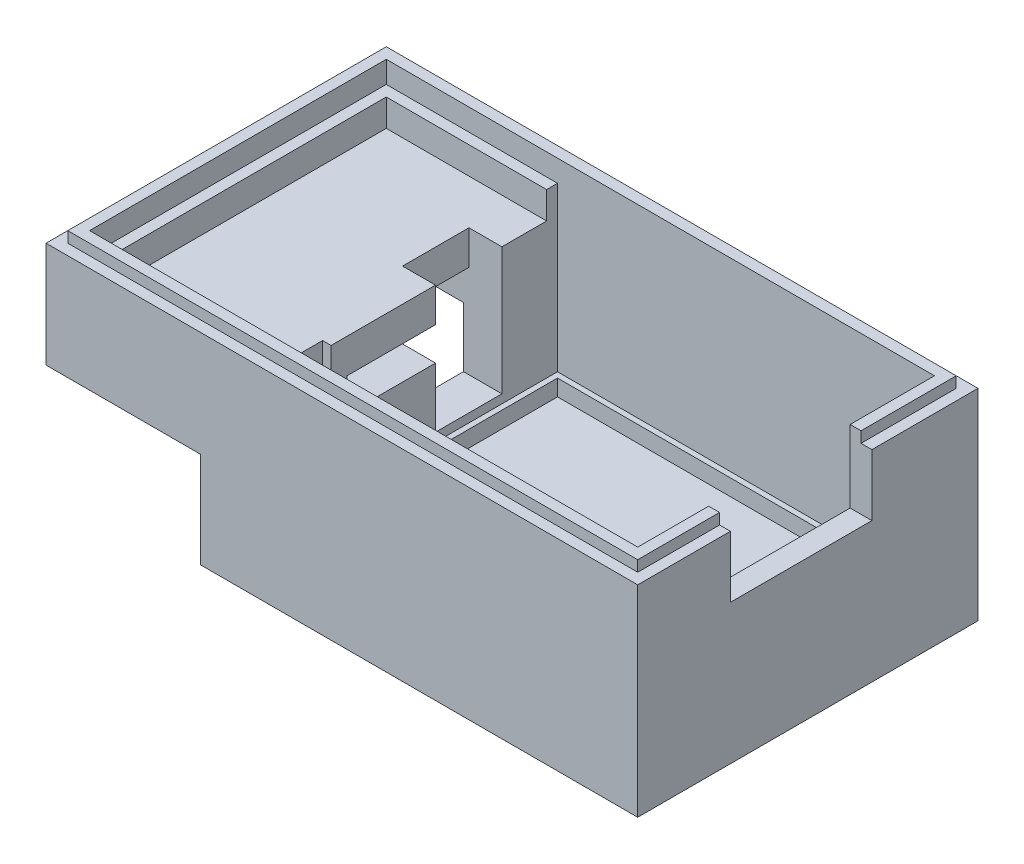
from build123d import *

# Parameters (mm, degrees)
EXTRUDE_1_DEPTH      = 32
EXTRUDE_1_DEPTH_BACK = 5
SKETCH_6_W           = 108.75
SKETCH_6_H           = 62.54
SKETCH_8_W           = 100.75
SKETCH_8_H           = 54.54
CUT_EXTRUDE_1_DEPTH  = 7
CUT_EXTRUDE_2_DEPTH  = 23.4
SKETCH_10_W          = 69.18
SKETCH_10_H          = 54.54
CUT_EXTRUDE_3_DEPTH  = 1.6
SKETCH_11_W          = 67.18
SKETCH_11_H          = 52.54
CUT_EXTRUDE_4_DEPTH  = 3
SKETCH_12_W          = 12.2
SKETCH_12_H          = 11
CUT_EXTRUDE_5_DEPTH  = 104.605353144
CUT_EXTRUDE_6_REACH  = 129.537
SKETCH_14_W          = 28.5
SKETCH_14_H          = 4.5
CUT_EXTRUDE_7_REACH  = 103.154
SKETCH_15_W          = 28.41
SKETCH_15_H          = 17.6
EXTRUDE_2_DEPTH      = 5
CUT_EXTRUDE_14_REACH = 129.537
SKETCH_23_W          = 28.5
SKETCH_23_H          = 1.6
SKETCH_25_W          = 104.75
SKETCH_25_H          = 58.54
SKETCH_25_W_2        = 100.75
SKETCH_25_H_2        = 54.54
EXTRUDE_3_DEPTH      = 2
SKETCH_26_W          = 26
SKETCH_26_H          = 13.3
CUT_EXTRUDE_15_DEPTH = 4


with BuildPart() as part:
    # ｽｹｯﾁ6 → ﾎﾞｽ - 押し出し1 (new, two sides: drawn at the far end of the back side and taken through both)
    with BuildSketch(Plane(origin=(0, 0, 0), x_dir=(1, 0, 0), z_dir=(0, 1, 0)).offset(-EXTRUDE_1_DEPTH_BACK)):
        with Locations((18.405, 27.17)):
            Rectangle(SKETCH_6_W, SKETCH_6_H)
    extrude(amount=EXTRUDE_1_DEPTH + EXTRUDE_1_DEPTH_BACK)

    # ｽｹｯﾁ8 → ｶｯﾄ - 押し出し1 (cut)
    with BuildSketch(Plane(origin=(0, 32, 0), x_dir=(1, 0, 0), z_dir=(0, 1, 0))):
        with Locations((18.405, 27.17)):
            Rectangle(SKETCH_8_W, SKETCH_8_H)
    extrude(amount=-CUT_EXTRUDE_1_DEPTH, mode=Mode.SUBTRACT)

    # ｽｹｯﾁ9 → ｶｯﾄ - 押し出し2 (cut)
    with BuildSketch(Plane(origin=(0, 25, 0), x_dir=(1, 0, 0), z_dir=(0, 1, 0))):
        Polygon((-0.5, 54.44), (-0.5, 44.22), (-6.56, 44.22), (-6.56, 32.02), (-0.5, 32.02), (-0.5, 12.82), (-2.06, 12.82), (-2.06, 3.62), (-0.5, 3.62), (-0.5, -0.1), (68.78, -0.1), (68.78, 54.44), align=None)
    extrude(amount=-CUT_EXTRUDE_2_DEPTH, mode=Mode.SUBTRACT)

    # ｽｹｯﾁ10 → ｶｯﾄ - 押し出し3 (cut)
    with BuildSketch(Plane(origin=(0, 1.6, 0), x_dir=(1, 0, 0), z_dir=(0, 1, 0))):
        with Locations((34.09, 27.17)):
            Rectangle(SKETCH_10_W, SKETCH_10_H)
    extrude(amount=-CUT_EXTRUDE_3_DEPTH, mode=Mode.SUBTRACT)

    # ｽｹｯﾁ11 → ｶｯﾄ - 押し出し4 (cut)
    with BuildSketch(Plane(origin=(0, 0, 0), x_dir=(1, 0, 0), z_dir=(0, 1, 0))):
        with Locations((34.09, 27.17)):
            Rectangle(SKETCH_11_W, SKETCH_11_H)
    extrude(amount=-CUT_EXTRUDE_4_DEPTH, mode=Mode.SUBTRACT)

    # ｽｹｯﾁ12 → ｶｯﾄ - 押し出し5 (cut, through all)
    with BuildSketch(Plane(origin=(-6.56, 0, 0), x_dir=(0, 0, -1), z_dir=(1, 0, 0))):
        with Locations((38.12, 7.1)):
            Rectangle(SKETCH_12_W, SKETCH_12_H)
    extrude(amount=-CUT_EXTRUDE_5_DEPTH, mode=Mode.SUBTRACT)

    # ｽｹｯﾁ14 → ｶｯﾄ - 押し出し6 (cut, up to next)
    with BuildSketch(Plane.ZY.offset(35.97), mode=Mode.PRIVATE) as cut_extrude_6_sk1:
        with Locations((-29.97, 16.45)):
            Rectangle(SKETCH_14_W, SKETCH_14_H)
    cut_extrude_6_tool1 = extrude(cut_extrude_6_sk1.sketch, amount=-CUT_EXTRUDE_6_REACH, mode=Mode.PRIVATE) & part.part
    add(cut_extrude_6_tool1.solids().sort_by_distance((-35.97, 16.45, -29.97))[0], mode=Mode.SUBTRACT)

    # ｶｯﾄ - 押し出し7: up to this face of the body (flat: up to its plane)
    cut_extrude_7_end = Plane(part.part.faces().sort_by_distance((18.405, 13.5, -58.44))[0])
    # ｽｹｯﾁ15 → ｶｯﾄ - 押し出し7 (cut, up to the picked face)
    with BuildSketch(Plane.XY.offset(4.1), mode=Mode.PRIVATE) as cut_extrude_7_sk1:
        with Locations((-21.765, 3.8)):
            Rectangle(SKETCH_15_W, SKETCH_15_H)
    cut_extrude_7_tool1 = split(extrude(cut_extrude_7_sk1.sketch, amount=-CUT_EXTRUDE_7_REACH, mode=Mode.PRIVATE), bisect_by=cut_extrude_7_end, keep=Keep.BOTH, mode=Mode.PRIVATE)
    add(cut_extrude_7_tool1.solids().sort_by(Axis((-21.765, 3.8, 4.1), (0, 0, -1)))[0], mode=Mode.SUBTRACT)

    # ｽｹｯﾁ16 → ﾎﾞｽ - 押し出し2 (add)
    with BuildSketch(Plane(origin=(0, 25, 0), x_dir=(1, 0, 0), z_dir=(0, 1, 0))):
        Polygon((-0.5, 54.44), (-31.97, 54.44), (-31.97, -0.1), (0, -0.1), (0, 1.9), (-29.97, 1.9), (-29.97, 52.44), (-0.5, 52.44), align=None)
    extrude(amount=EXTRUDE_2_DEPTH)

    # ｽｹｯﾁ23 → ｶｯﾄ - 押し出し14 (cut, up to next)
    with BuildSketch(Plane.ZY.offset(35.97), mode=Mode.PRIVATE) as cut_extrude_14_sk1:
        with Locations((-29.97, 13.4)):
            Rectangle(SKETCH_23_W, SKETCH_23_H)
    cut_extrude_14_tool1 = extrude(cut_extrude_14_sk1.sketch, amount=-CUT_EXTRUDE_14_REACH, mode=Mode.PRIVATE) & part.part
    add(cut_extrude_14_tool1.solids().sort_by_distance((-35.97, 13.4, -29.97))[0], mode=Mode.SUBTRACT)

    # ｽｹｯﾁ25 → ﾎﾞｽ - 押し出し3 (add)
    with BuildSketch(Plane(origin=(0, 32, 0), x_dir=(1, 0, 0), z_dir=(0, 1, 0))):
        with Locations((18.405, 27.17)):
            Rectangle(SKETCH_25_W, SKETCH_25_H)
        with Locations((18.405, 27.17)):
            Rectangle(SKETCH_25_W_2, SKETCH_25_H_2, mode=Mode.SUBTRACT)
    extrude(amount=EXTRUDE_3_DEPTH)

    # ｽｹｯﾁ26 → ｶｯﾄ - 押し出し15 (cut)
    with BuildSketch(Plane.ZY.offset(-68.78)):
        with Locations((-25.94, 27.35)):
            Rectangle(SKETCH_26_W, SKETCH_26_H)
    extrude(amount=-CUT_EXTRUDE_15_DEPTH, mode=Mode.SUBTRACT)


solid = part.part
